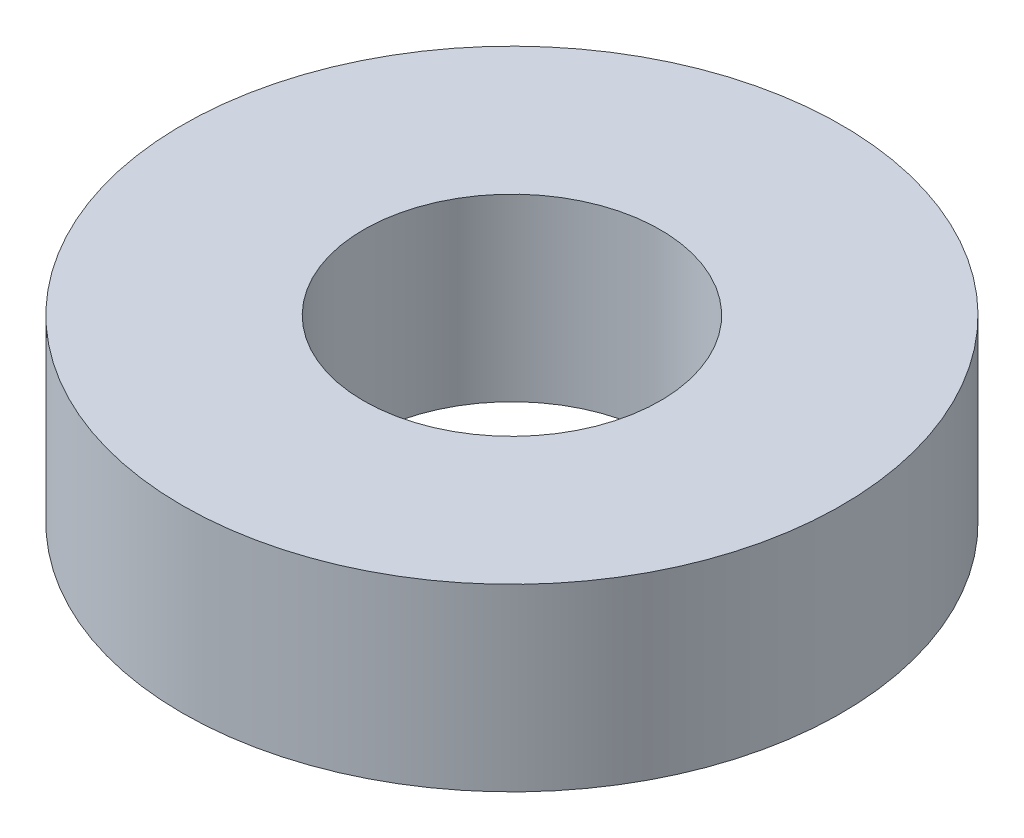
from build123d import *

# Parameters (mm, degrees)
ESQUISSE1_R        = 11
ESQUISSE1_R_2      = 4.95
BOSS_EXTRU_1_DEPTH = 6


with BuildPart() as part:
    # Esquisse1 → Boss.-Extru.1 (new body)
    with BuildSketch(Plane(origin=(0, 0, 0), x_dir=(1, 0, 0), z_dir=(0, 1, 0))):
        with Locations(Location((0, 0, 0), (0, 0, 270))):
            Circle(ESQUISSE1_R)
        with Locations(Location((0, 0, 0), (0, 0, 270))):
            Circle(ESQUISSE1_R_2, mode=Mode.SUBTRACT)
    extrude(amount=BOSS_EXTRU_1_DEPTH)


solid = part.part
